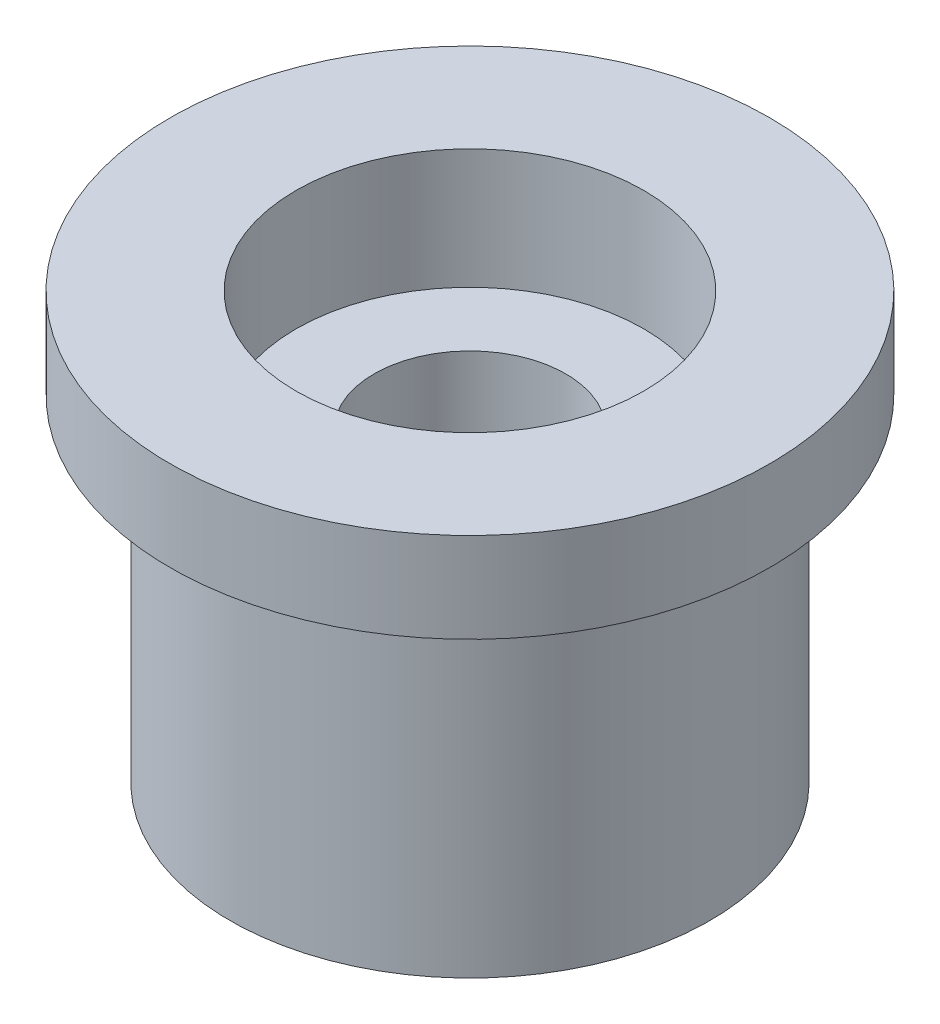
from build123d import *

# Parameters (mm, degrees)
SKETCH_1_W                   = 5
SKETCH_1_H                   = 1.5
SKETCH_2_R                   = 4
EXTRUDE_1_DEPTH              = 5.6
CUT_EXTRUDE_1_DEPTH          = 4.3
CUT_EXTRUDE_2_DEPTH          = 4.3
CUT_EXTRUDE_3_DEPTH          = 4.3
HOLE_WIZARD_M3_1_D           = 3.2
HOLE_WIZARD_M3_1_CBORE_D     = 5.8
HOLE_WIZARD_M3_1_CBORE_DEPTH = 2


with BuildPart() as part:
    # 스케치1 → 회전1 (revolve)
    with BuildSketch(Plane.XY, mode=Mode.PRIVATE) as revolve_1_sk:
        with Locations((2.5, 6.35)):
            Rectangle(SKETCH_1_W, SKETCH_1_H)
    revolve(revolve_1_sk.sketch.rotate(Axis((0, 7.1, 0), (0, -1, 0)), 270), axis=Axis((0, 7.1, 0), (0, -1, 0)))

    # 스케치2 → 보스-돌출1 (add)
    with BuildSketch(Plane.XZ.offset(-5.6)):
        with Locations(Location((0, 0, 0), (0, 0, 270))):
            Circle(SKETCH_2_R)
    extrude(amount=EXTRUDE_1_DEPTH)

    # 스케치3 → 컷-돌출1 (cut)
    with BuildSketch(Plane.XZ):
        with BuildLine():
            Line((-1.190632453, 2.862235902), (-0.786065004, 2.161504525))
            ThreePointArc((-0.786065004, 2.161504525), (1.15, 1.991858429), (2.264950331, 0.4))
            Line((2.264950331, 0.4), (3.07408523, 0.4))
            ThreePointArc((3.07408523, 0.4), (1.55, 2.684678752), (-1.190632453, 2.862235902))
        make_face()
    extrude(amount=-CUT_EXTRUDE_1_DEPTH, mode=Mode.SUBTRACT)

    # 스케치4 → 컷-돌출2 (cut)
    with BuildSketch(Plane.XZ):
        with BuildLine():
            Line((-0.786065004, -2.161504525), (-1.190632453, -2.862235902))
            ThreePointArc((-1.190632453, -2.862235902), (1.55, -2.684678752), (3.07408523, -0.4))
            Line((3.07408523, -0.4), (2.264950331, -0.4))
            ThreePointArc((2.264950331, -0.4), (1.15, -1.991858429), (-0.786065004, -2.161504525))
        make_face()
    extrude(amount=-CUT_EXTRUDE_2_DEPTH, mode=Mode.SUBTRACT)

    # 스케치5 → 컷-돌출3 (cut)
    with BuildSketch(Plane.XZ):
        with BuildLine():
            Line((-1.883452776, -2.462235902), (-1.478885327, -1.761504525))
            ThreePointArc((-1.478885327, -1.761504525), (-2.3, 0), (-1.478885327, 1.761504525))
            Line((-1.478885327, 1.761504525), (-1.883452776, 2.462235902))
            ThreePointArc((-1.883452776, 2.462235902), (-3.1, 0), (-1.883452776, -2.462235902))
        make_face()
    extrude(amount=-CUT_EXTRUDE_3_DEPTH, mode=Mode.SUBTRACT)

    # M3 육각 머리 작은 나사용 카운터보어1 (through all)
    with Locations(Plane(origin=(0, 7.1, 0), x_dir=(1, 0, 0), z_dir=(0, 1, 0))):
        with Locations((0, 0)):
            CounterBoreHole(HOLE_WIZARD_M3_1_D / 2, HOLE_WIZARD_M3_1_CBORE_D / 2, HOLE_WIZARD_M3_1_CBORE_DEPTH)


solid = part.part
